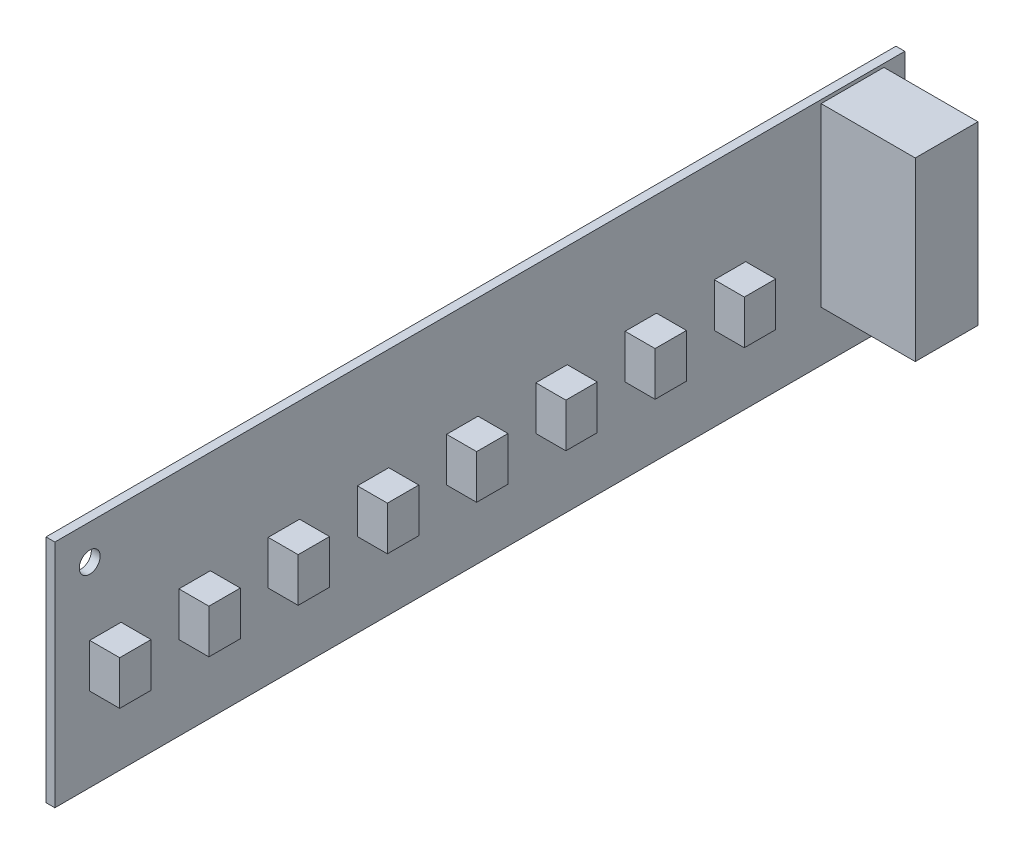
from build123d import *

# Parameters (mm, degrees)
SKETCH1_W           = 121.92
SKETCH1_H           = 33.02
SKETCH1_R           = 1.5
BOSS_EXTRUDE1_DEPTH = 1.27
SKETCH2_W           = 9
SKETCH2_H           = 25.3
BOSS_EXTRUDE2_DEPTH = 13.5
SKETCH3_W           = 4.5
SKETCH3_H           = 6.3
BOSS_EXTRUDE3_DEPTH = 4.3


with BuildPart() as part:
    # Sketch1 → Boss-Extrude1 (new body)
    with BuildSketch(Plane(origin=(0, 0, 0), x_dir=(0, 0, -1), z_dir=(1, 0, 0))):
        with Locations((60.96, 16.51)):
            Rectangle(SKETCH1_W, SKETCH1_H)
        with Locations((5, 28.02)):
            Circle(SKETCH1_R, mode=Mode.SUBTRACT)
    extrude(amount=BOSS_EXTRUDE1_DEPTH)

    # Sketch2 → Boss-Extrude2 (add)
    with BuildSketch(Plane(origin=(1.27, 0, 0), x_dir=(0, 0, -1), z_dir=(1, 0, 0))):
        with Locations((114.42, 19.87)):
            Rectangle(SKETCH2_W, SKETCH2_H)
    extrude(amount=BOSS_EXTRUDE2_DEPTH)

    # Sketch3 → Boss-Extrude3 (add)
    with BuildSketch(Plane(origin=(1.27, 0, 0), x_dir=(0, 0, -1), z_dir=(1, 0, 0))):
        with Locations((7.25, 15.15)):
            Rectangle(SKETCH3_W, SKETCH3_H)
        with Locations((20.05, 15.15)):
            Rectangle(SKETCH3_W, SKETCH3_H)
        with Locations((32.85, 15.15)):
            Rectangle(SKETCH3_W, SKETCH3_H)
        with Locations((45.65, 15.15)):
            Rectangle(SKETCH3_W, SKETCH3_H)
        with Locations((58.45, 15.15)):
            Rectangle(SKETCH3_W, SKETCH3_H)
        with Locations((71.25, 15.15)):
            Rectangle(SKETCH3_W, SKETCH3_H)
        with Locations((84.05, 15.15)):
            Rectangle(SKETCH3_W, SKETCH3_H)
        with Locations((96.85, 15.15)):
            Rectangle(SKETCH3_W, SKETCH3_H)
    extrude(amount=BOSS_EXTRUDE3_DEPTH)


solid = part.part
